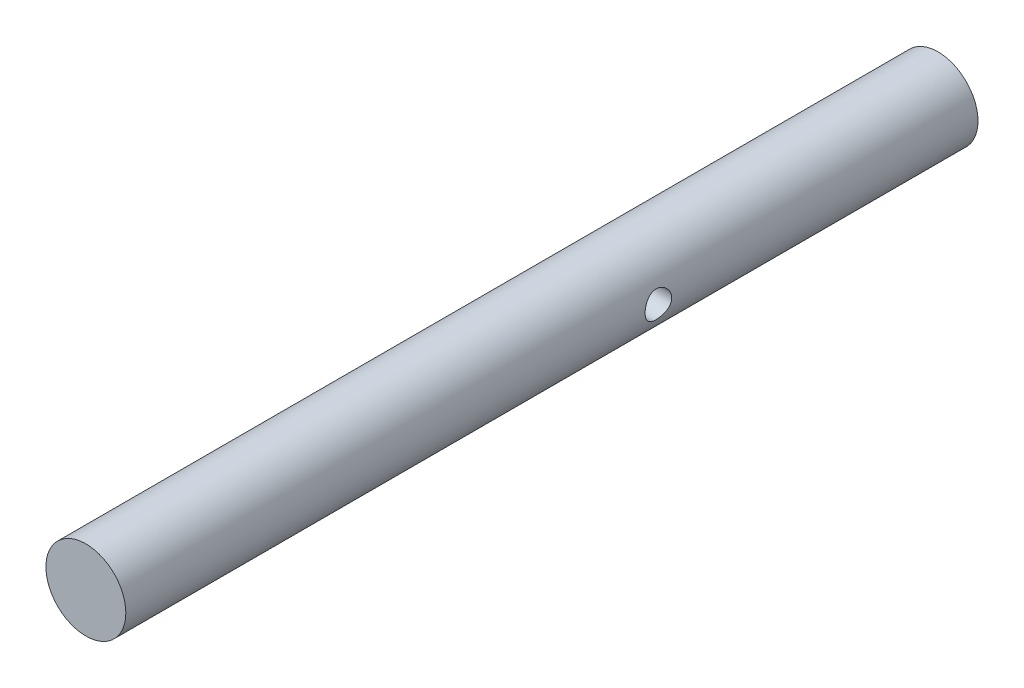
from build123d import *

# Parameters (mm, degrees)
SKETCH1_R               = 4.7625
BOSS_EXTRUDE1_DEPTH     = 101.6
CUT_EXTRUDE1_DEPTH      = 4.7625
CUT_EXTRUDE1_DEPTH_BACK = 4.7625
SKETCH2_R               = 1.5875


with BuildPart() as part:
    # Sketch1 → Boss-Extrude1 (new body)
    with BuildSketch(Plane.XY):
        Circle(SKETCH1_R)
    extrude(amount=BOSS_EXTRUDE1_DEPTH)

    # Sketch2 → Cut-Extrude1 (cut, two sides: drawn at the far end of the back side and taken through both)
    with BuildSketch(Plane(origin=(0, 0, 0), x_dir=(0, 0, -1), z_dir=(1, 0, 0)).offset(-CUT_EXTRUDE1_DEPTH_BACK)):
        with Locations((-38.1, 0)):
            Circle(SKETCH2_R)
    extrude(amount=CUT_EXTRUDE1_DEPTH + CUT_EXTRUDE1_DEPTH_BACK, mode=Mode.SUBTRACT)


solid = part.part
